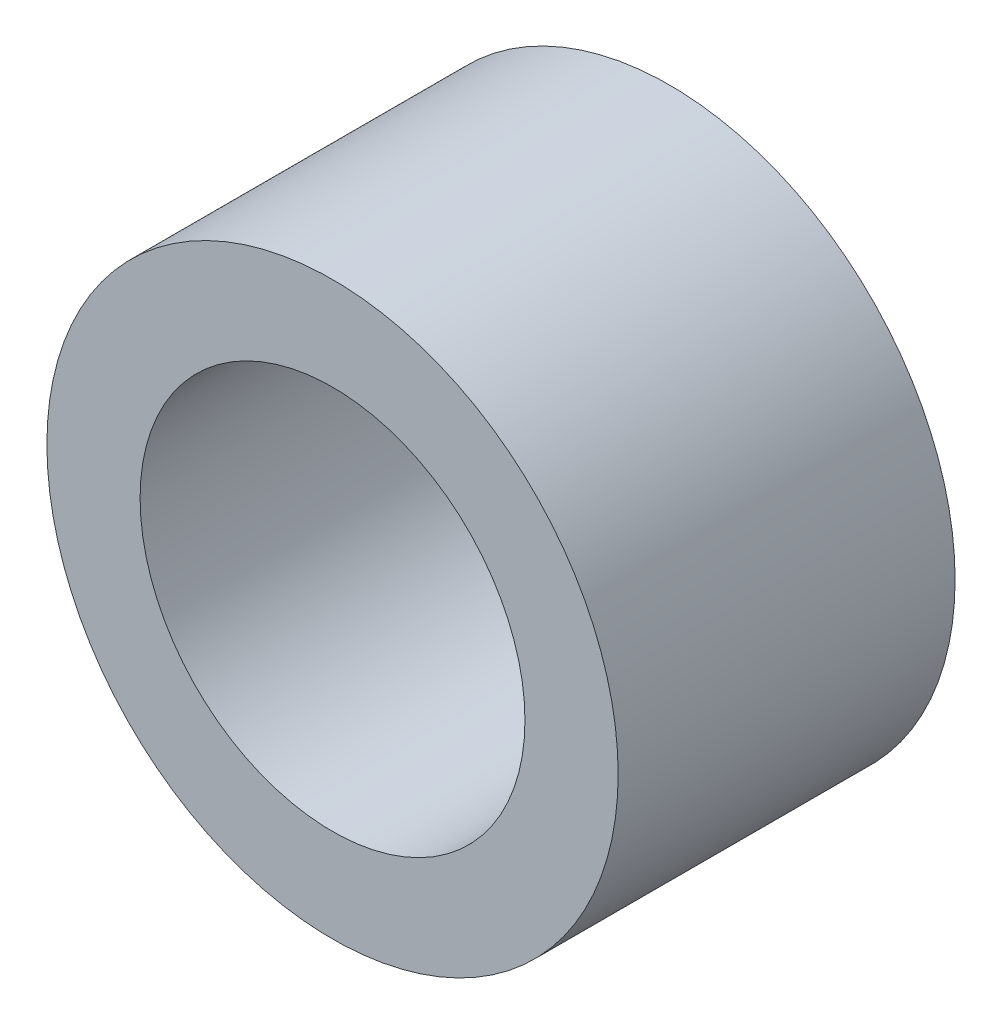
from build123d import *

# Parameters (mm, degrees)
SKETCH3_R           = 5.9
SKETCH3_R_2         = 3.975
BOSS_EXTRUDE1_DEPTH = 6.96


with BuildPart() as part:
    # Sketch3 → Boss-Extrude1 (new body)
    with BuildSketch(Plane.XY):
        Circle(SKETCH3_R)
        Circle(SKETCH3_R_2, mode=Mode.SUBTRACT)
    extrude(amount=BOSS_EXTRUDE1_DEPTH)


solid = part.part
